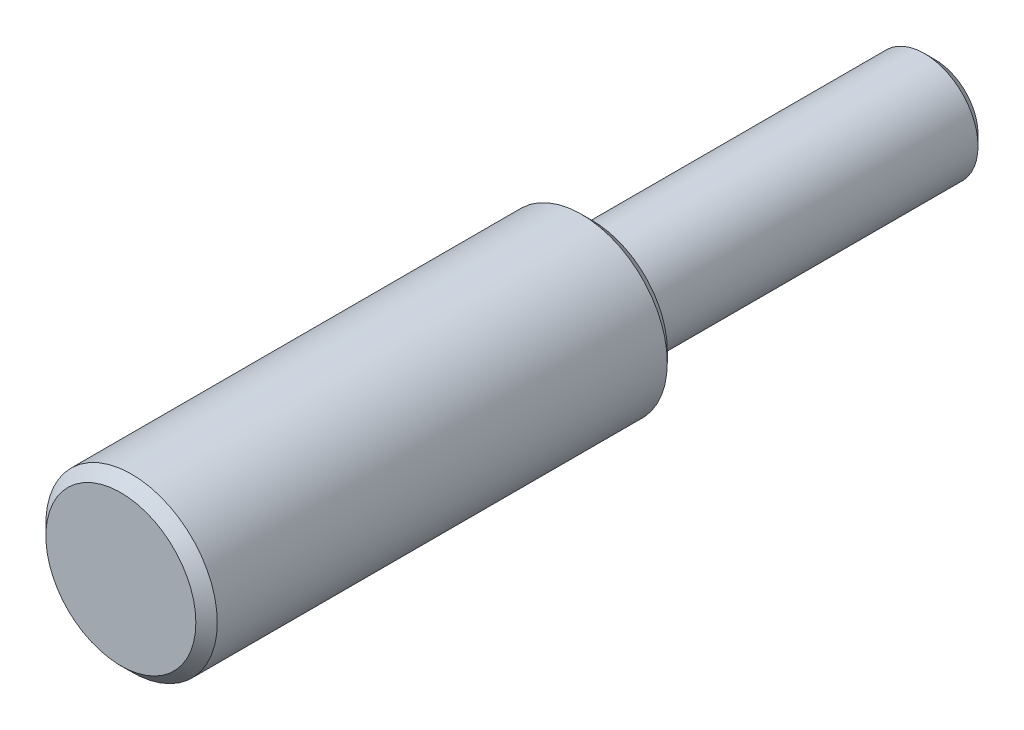
from build123d import *

# Parameters (mm, degrees)
SKETCH1_R           = 2.5
BOSS_EXTRUDE1_DEPTH = 16
SKETCH2_R           = 4
BOSS_EXTRUDE2_DEPTH = 22
CHAMFER1_SIZE       = 0.5
FILLET1_R           = 0.5


with BuildPart() as part:
    # Sketch1 → Boss-Extrude1 (new body)
    with BuildSketch(Plane.XY):
        Circle(SKETCH1_R)
    extrude(amount=BOSS_EXTRUDE1_DEPTH)

    # Sketch2 → Boss-Extrude2 (add)
    with BuildSketch(Plane.XY.offset(16)):
        Circle(SKETCH2_R)
    extrude(amount=BOSS_EXTRUDE2_DEPTH)

    # Chamfer1
    chamfer1_edges = [part.edges().sort_by_distance(p)[0] for p in [
        (-2.5, 0, 0),
        (-4, 0, 16),
        (-4, 0, 38),
    ]]
    chamfer(chamfer1_edges, length=CHAMFER1_SIZE)

    # Fillet1
    fillet1_edges = [part.edges().sort_by_distance(p)[0] for p in [
        (-2.5, 0, 16),
    ]]
    fillet(fillet1_edges, radius=FILLET1_R)


solid = part.part
